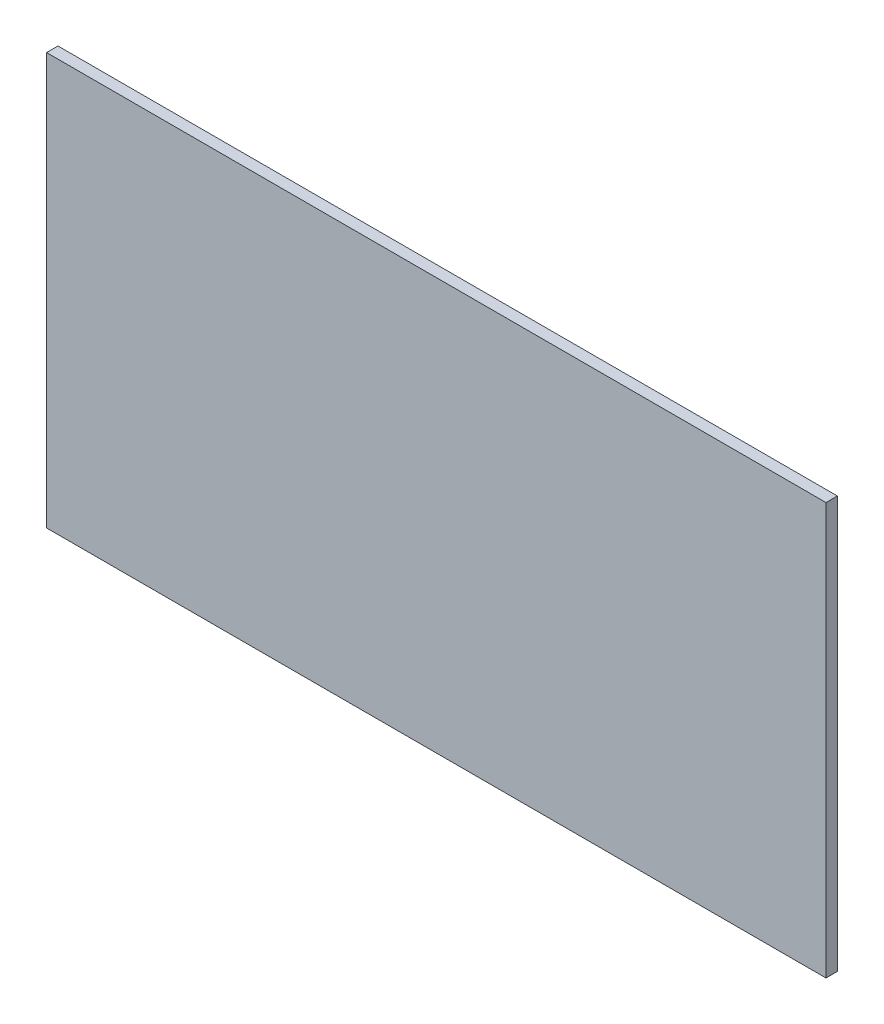
from build123d import *

# Parameters (mm, degrees)
ESQUISSE1_W        = 106
ESQUISSE1_H        = 56
BOSS_EXTRU_1_DEPTH = 1.55


with BuildPart() as part:
    # Esquisse1 → Boss.-Extru.1 (new body)
    with BuildSketch(Plane.XY):
        with Locations((53, 28)):
            Rectangle(ESQUISSE1_W, ESQUISSE1_H)
    extrude(amount=BOSS_EXTRU_1_DEPTH)


solid = part.part
